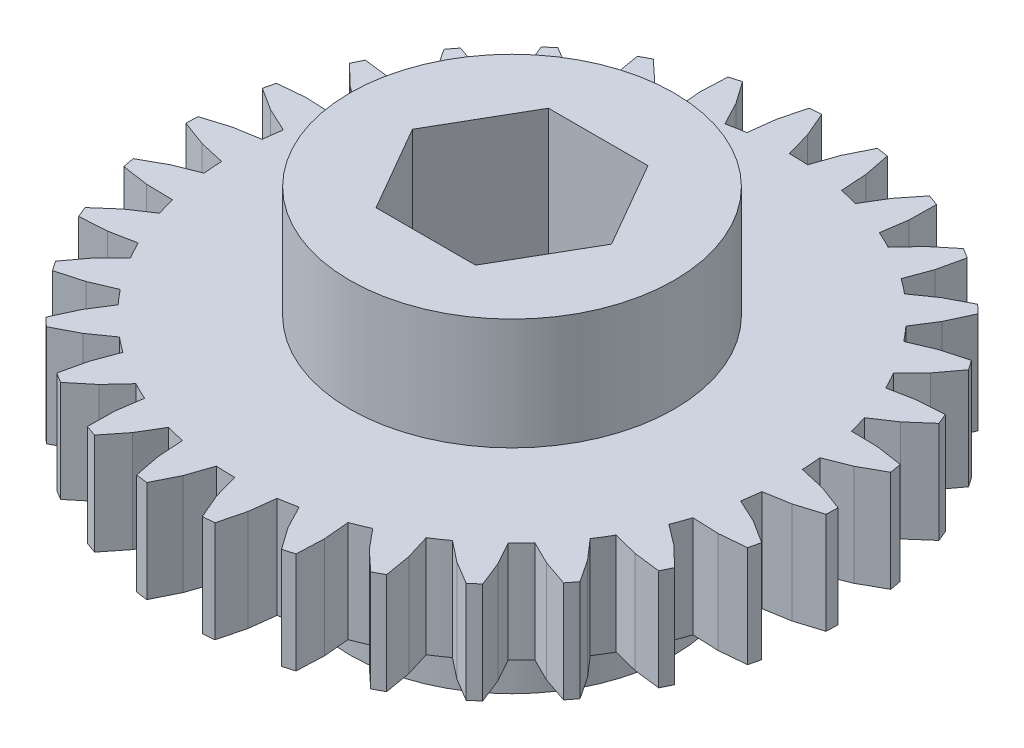
from build123d import *

# Parameters (mm, degrees)
BOSS_EXTRUDE1_DEPTH      = 2.5
BOSS_EXTRUDE1_DEPTH_BACK = 2.5
SKETCH2_R                = 16.25
CUT_EXTRUDE1_DEPTH       = 24.116552511
CUT_EXTRUDE1_DEPTH_BACK  = 24.116552511
BOSS_EXTRUDE2_DEPTH      = 8
BOSS_EXTRUDE2_DEPTH_BACK = 8
SKETCH3_R                = 8
CUT_EXTRUDE2_DEPTH       = 25.314429682
CUT_EXTRUDE2_DEPTH_BACK  = 25.314429682


with BuildPart() as part:
    # Sketch2 → Boss-Extrude1 (new, two sides: drawn at the far end of the back side and taken through both)
    with BuildSketch(Plane(origin=(0, 0, 0), x_dir=(1, 0, 0), z_dir=(0, 1, 0)).offset(-BOSS_EXTRUDE1_DEPTH_BACK)):
        Circle(SKETCH2_R)
    extrude(amount=BOSS_EXTRUDE1_DEPTH + BOSS_EXTRUDE1_DEPTH_BACK)

    # Sketch1 → Cut-Extrude1 (cut, two sides: drawn at the far end of the back side and taken through both)
    with BuildSketch(Plane(origin=(0, 0, 0), x_dir=(1, 0, 0), z_dir=(0, 1, 0)).offset(-CUT_EXTRUDE1_DEPTH_BACK)):
        with BuildLine():
            Line((1.274506229, 14.945756383), (0.855128204, 13.723383539))
            ThreePointArc((0.855128204, 13.723383539), (0.389575726, 13.74448001), (-0.076424274, 13.74978761))
            Line((-0.076424274, 13.74978761), (-0.425890357, 14.993952694))
            Line((-0.425890357, 14.993952694), (-0.95097387, 16.222149941))
            ThreePointArc((-0.95097387, 16.222149941), (0.460407676, 16.243476376), (1.86831527, 16.142239561))
            Line((1.86831527, 16.142239561), (1.274506229, 14.945756383))
        make_face()
        with BuildLine():
            Line((4.354052691, 14.354171002), (5.18364842, 15.40104831))
            ThreePointArc((5.18364842, 15.40104831), (3.827555302, 15.792793306), (2.442581813, 16.065375629))
            Line((2.442581813, 16.065375629), (2.700834426, 14.754846438))
            Line((2.700834426, 14.754846438), (2.78398737, 13.465211262))
            ThreePointArc((2.78398737, 13.465211262), (3.23870064, 13.363132798), (3.689693476, 13.245703532))
            Line((3.689693476, 13.245703532), (4.354052691, 14.354171002))
        make_face()
        with BuildLine():
            Line((7.243306156, 13.13523947), (8.272431259, 13.986757346))
            ThreePointArc((8.272431259, 13.986757346), (7.027420394, 14.651889387), (5.729384951, 15.206467311))
            Line((5.729384951, 15.206467311), (5.709519785, 13.87088259))
            Line((5.709519785, 13.87088259), (5.522725407, 12.592140568))
            ThreePointArc((5.522725407, 12.592140568), (5.946278795, 12.397752558), (6.363001438, 12.18912272))
            Line((6.363001438, 12.18912272), (7.243306156, 13.13523947))
        make_face()
        with BuildLine():
            Line((9.815992386, 11.342234942), (10.999669158, 11.96117797))
            ThreePointArc((10.999669158, 11.96117797), (9.920153494, 12.870627594), (8.765786473, 13.682963404))
            Line((8.765786473, 13.682963404), (8.468671731, 12.380694613))
            Line((8.468671731, 12.380694613), (8.020093843, 11.168732907))
            ThreePointArc((8.020093843, 11.168732907), (8.393976033, 10.890531041), (8.758215705, 10.599818756))
            Line((8.758215705, 10.599818756), (9.815992386, 11.342234942))
        make_face()
        with BuildLine():
            Line((11.959672645, 9.053520322), (13.246168731, 9.41283772))
            ThreePointArc((13.246168731, 9.41283772), (12.379328284, 10.526857615), (11.419081064, 11.561448337))
            Line((11.419081064, 11.561448337), (10.857702086, 10.349410873))
            Line((10.857702086, 10.349410873), (10.166945693, 9.257198025))
            ThreePointArc((10.166945693, 9.257198025), (10.47481624, 8.907341059), (10.770653918, 8.547251849))
            Line((10.770653918, 8.547251849), (11.959672645, 9.053520322))
        make_face()
        with BuildLine():
            Line((13.580657821, 6.36912342), (14.913747169, 6.453111294))
            ThreePointArc((14.913747169, 6.453111294), (14.297467025, 7.723013444), (13.573307018, 8.9346425))
            Line((13.573307018, 8.9346425), (12.772198758, 7.865808215))
            Line((12.772198758, 7.865808215), (11.86945323, 6.941079168))
            ThreePointArc((11.86945323, 6.941079168), (12.097856714, 6.53485753), (12.312362872, 6.121129022))
            Line((12.312362872, 6.121129022), (13.580657821, 6.36912342))
        make_face()
        with BuildLine():
            Line((14.608103084, 3.406365262), (15.929523292, 3.211352939))
            ThreePointArc((15.929523292, 3.211352939), (15.590737851, 4.581636527), (15.134314322, 5.917349913))
            Line((15.134314322, 5.917349913), (14.128489057, 5.038431994))
            Line((14.128489057, 5.038431994), (13.053208705, 4.321601844))
            ThreePointArc((13.053208705, 4.321601844), (13.192162797, 3.876769369), (13.315962488, 3.427483483))
            Line((13.315962488, 3.427483483), (14.608103084, 3.406365262))
        make_face()
        with BuildLine():
            Line((14.997104144, 0.294732596), (16.249102808, -0.170756949))
            ThreePointArc((16.249102808, -0.170756949), (16.20261862, 1.240020109), (16.033879469, 2.64144074))
            Line((16.033879469, 2.64144074), (14.867296588, 1.990852118))
            Line((14.867296588, 1.990852118), (13.666476323, 1.513249783))
            ThreePointArc((13.666476323, 1.513249783), (13.709908063, 1.049247785), (13.737590645, 0.58404047))
            Line((13.737590645, 0.58404047), (14.997104144, 0.294732596))
        make_face()
        with BuildLine():
            Line((14.730659789, -2.829781298), (15.85851856, -3.545403939))
            ThreePointArc((15.85851856, -3.545403939), (16.106367206, -2.155791138), (16.232687143, -0.749912068))
            Line((16.232687143, -0.749912068), (14.956331917, -1.143737549))
            Line((14.956331917, -1.143737549), (13.682453347, -1.361238555))
            ThreePointArc((13.682453347, -1.361238555), (13.628464559, -1.824130963), (13.558820171, -2.284927914))
            Line((13.558820171, -2.284927914), (14.730659789, -2.829781298))
        make_face()
        with BuildLine():
            Line((13.820414915, -5.830620171), (14.774840953, -6.765099764))
            ThreePointArc((14.774840953, -6.765099764), (15.306190258, -5.457383968), (15.722048497, -4.108490121))
            Line((15.722048497, -4.108490121), (14.391703773, -4.228340396))
            Line((14.391703773, -4.228340396), (13.100441504, -4.176234237))
            ThreePointArc((13.100441504, -4.176234237), (12.951391757, -4.617786435), (12.787464193, -5.054033984))
            Line((12.787464193, -5.054033984), (13.820414915, -5.830620171))
        make_face()
        with BuildLine():
            Line((12.306151592, -8.576632964), (13.045431899, -9.689128267))
            ThreePointArc((13.045431899, -9.689128267), (13.837059349, -8.520462932), (14.524280888, -7.28750744))
            Line((14.524280888, -7.28750744), (13.198089115, -7.128144479))
            Line((13.198089115, -7.128144479), (11.945877504, -6.808708442))
            ThreePointArc((11.945877504, -6.808708442), (11.708280988, -7.209622481), (11.457234669, -7.602254517))
            Line((11.457234669, -7.602254517), (12.306151592, -8.576632964))
        make_face()
        with BuildLine():
            Line((10.254050393, -10.947805741), (10.745874872, -12.189695371))
            ThreePointArc((10.745874872, -12.189695371), (11.763182549, -11.211156779), (12.691732509, -10.148025715))
            Line((12.691732509, -10.148025715), (11.427654631, -9.716414443))
            Line((11.427654631, -9.716414443), (10.269221335, -9.143609417))
            ThreePointArc((10.269221335, -9.143609417), (9.953462157, -9.486363428), (9.626269012, -9.818220048))
            Line((9.626269012, -9.818220048), (10.254050393, -10.947805741))
        make_face()
        with BuildLine():
            Line((7.753797987, -12.840506874), (7.976671549, -14.157514295))
            ThreePointArc((7.976671549, -14.157514295), (9.175198225, -13.411869278), (10.304494518, -12.565026571))
            Line((10.304494518, -12.565026571), (9.157776804, -11.880030472))
            Line((9.157776804, -11.880030472), (8.143750916, -11.078890785))
            ThreePointArc((8.143750916, -11.078890785), (7.763629268, -11.348504774), (7.374589207, -11.60508225))
            Line((7.374589207, -11.60508225), (7.753797987, -12.840506874))
        make_face()
        with BuildLine():
            Line((4.914667403, -14.17201624), (4.858849402, -15.506581909))
            ThreePointArc((4.858849402, -15.506581909), (6.186213712, -15.026418732), (7.46690067, -14.432875472))
            Line((7.46690067, -14.432875472), (6.487660186, -13.524432162))
            Line((6.487660186, -13.524432162), (5.662359504, -12.529971462))
            ThreePointArc((5.662359504, -12.529971462), (5.234488525, -12.714662004), (4.800604466, -12.88474667))
            Line((4.800604466, -12.88474667), (4.914667403, -14.17201624))
        make_face()
        with BuildLine():
            Line((1.86074227, -14.884140493), (1.528672222, -16.177937484))
            ThreePointArc((1.528672222, -16.177937484), (2.926861974, -15.984241583), (4.302967432, -15.669938458))
            Line((4.302967432, -15.669938458), (3.534001687, -14.577751269))
            Line((3.534001687, -14.577751269), (2.933495811, -13.433432262))
            ThreePointArc((2.933495811, -13.433432262), (2.476575517, -13.525127493), (2.016810275, -13.601285833))
            Line((2.016810275, -13.601285833), (1.86074227, -14.884140493))
        make_face()
        with BuildLine():
            Line((-1.274506229, -14.945756383), (-1.86831527, -16.142239561))
            ThreePointArc((-1.86831527, -16.142239561), (-0.460407676, -16.243476376), (0.95097387, -16.222149941))
            Line((0.95097387, -16.222149941), (0.425890357, -14.993952694))
            Line((0.425890357, -14.993952694), (0.076424274, -13.74978761))
            ThreePointArc((0.076424274, -13.74978761), (-0.389575726, -13.74448001), (-0.855128204, -13.723383539))
            Line((-0.855128204, -13.723383539), (-1.274506229, -14.945756383))
        make_face()
        with BuildLine():
            Line((-4.354052691, -14.354171002), (-5.18364842, -15.40104831))
            ThreePointArc((-5.18364842, -15.40104831), (-3.827555302, -15.792793306), (-2.442581813, -16.065375629))
            Line((-2.442581813, -16.065375629), (-2.700834426, -14.754846438))
            Line((-2.700834426, -14.754846438), (-2.78398737, -13.465211262))
            ThreePointArc((-2.78398737, -13.465211262), (-3.23870064, -13.363132798), (-3.689693476, -13.245703532))
            Line((-3.689693476, -13.245703532), (-4.354052691, -14.354171002))
        make_face()
        with BuildLine():
            Line((-7.243306156, -13.13523947), (-8.272431259, -13.986757346))
            ThreePointArc((-8.272431259, -13.986757346), (-7.027420394, -14.651889387), (-5.729384951, -15.206467311))
            Line((-5.729384951, -15.206467311), (-5.709519785, -13.87088259))
            Line((-5.709519785, -13.87088259), (-5.522725407, -12.592140568))
            ThreePointArc((-5.522725407, -12.592140568), (-5.946278795, -12.397752558), (-6.363001438, -12.18912272))
            Line((-6.363001438, -12.18912272), (-7.243306156, -13.13523947))
        make_face()
        with BuildLine():
            Line((-9.815992386, -11.342234942), (-10.999669158, -11.96117797))
            ThreePointArc((-10.999669158, -11.96117797), (-9.920153494, -12.870627594), (-8.765786473, -13.682963404))
            Line((-8.765786473, -13.682963404), (-8.468671731, -12.380694613))
            Line((-8.468671731, -12.380694613), (-8.020093843, -11.168732907))
            ThreePointArc((-8.020093843, -11.168732907), (-8.393976033, -10.890531041), (-8.758215705, -10.599818756))
            Line((-8.758215705, -10.599818756), (-9.815992386, -11.342234942))
        make_face()
        with BuildLine():
            Line((-11.959672645, -9.053520322), (-13.246168731, -9.41283772))
            ThreePointArc((-13.246168731, -9.41283772), (-12.379328284, -10.526857615), (-11.419081064, -11.561448337))
            Line((-11.419081064, -11.561448337), (-10.857702086, -10.349410873))
            Line((-10.857702086, -10.349410873), (-10.166945693, -9.257198025))
            ThreePointArc((-10.166945693, -9.257198025), (-10.47481624, -8.907341059), (-10.770653918, -8.547251849))
            Line((-10.770653918, -8.547251849), (-11.959672645, -9.053520322))
        make_face()
        with BuildLine():
            Line((-13.580657821, -6.36912342), (-14.913747169, -6.453111294))
            ThreePointArc((-14.913747169, -6.453111294), (-14.297467025, -7.723013444), (-13.573307018, -8.9346425))
            Line((-13.573307018, -8.9346425), (-12.772198758, -7.865808215))
            Line((-12.772198758, -7.865808215), (-11.86945323, -6.941079168))
            ThreePointArc((-11.86945323, -6.941079168), (-12.097856714, -6.53485753), (-12.312362872, -6.121129022))
            Line((-12.312362872, -6.121129022), (-13.580657821, -6.36912342))
        make_face()
        with BuildLine():
            Line((-14.608103084, -3.406365262), (-15.929523292, -3.211352939))
            ThreePointArc((-15.929523292, -3.211352939), (-15.590737851, -4.581636527), (-15.134314322, -5.917349913))
            Line((-15.134314322, -5.917349913), (-14.128489057, -5.038431994))
            Line((-14.128489057, -5.038431994), (-13.053208705, -4.321601844))
            ThreePointArc((-13.053208705, -4.321601844), (-13.192162797, -3.876769369), (-13.315962488, -3.427483483))
            Line((-13.315962488, -3.427483483), (-14.608103084, -3.406365262))
        make_face()
        with BuildLine():
            Line((-14.997104144, -0.294732596), (-16.249102808, 0.170756949))
            ThreePointArc((-16.249102808, 0.170756949), (-16.20261862, -1.240020109), (-16.033879469, -2.64144074))
            Line((-16.033879469, -2.64144074), (-14.867296588, -1.990852118))
            Line((-14.867296588, -1.990852118), (-13.666476323, -1.513249783))
            ThreePointArc((-13.666476323, -1.513249783), (-13.709908063, -1.049247785), (-13.737590645, -0.58404047))
            Line((-13.737590645, -0.58404047), (-14.997104144, -0.294732596))
        make_face()
        with BuildLine():
            Line((-14.730659789, 2.829781298), (-15.85851856, 3.545403939))
            ThreePointArc((-15.85851856, 3.545403939), (-16.106367206, 2.155791138), (-16.232687143, 0.749912068))
            Line((-16.232687143, 0.749912068), (-14.956331917, 1.143737549))
            Line((-14.956331917, 1.143737549), (-13.682453347, 1.361238555))
            ThreePointArc((-13.682453347, 1.361238555), (-13.628464559, 1.824130963), (-13.558820171, 2.284927914))
            Line((-13.558820171, 2.284927914), (-14.730659789, 2.829781298))
        make_face()
        with BuildLine():
            Line((-13.820414915, 5.830620171), (-14.774840953, 6.765099764))
            ThreePointArc((-14.774840953, 6.765099764), (-15.306190258, 5.457383968), (-15.722048497, 4.108490121))
            Line((-15.722048497, 4.108490121), (-14.391703773, 4.228340396))
            Line((-14.391703773, 4.228340396), (-13.100441504, 4.176234237))
            ThreePointArc((-13.100441504, 4.176234237), (-12.951391757, 4.617786435), (-12.787464193, 5.054033984))
            Line((-12.787464193, 5.054033984), (-13.820414915, 5.830620171))
        make_face()
        with BuildLine():
            Line((-12.306151592, 8.576632964), (-13.045431899, 9.689128267))
            ThreePointArc((-13.045431899, 9.689128267), (-13.837059349, 8.520462932), (-14.524280888, 7.28750744))
            Line((-14.524280888, 7.28750744), (-13.198089115, 7.128144479))
            Line((-13.198089115, 7.128144479), (-11.945877504, 6.808708442))
            ThreePointArc((-11.945877504, 6.808708442), (-11.708280988, 7.209622481), (-11.457234669, 7.602254517))
            Line((-11.457234669, 7.602254517), (-12.306151592, 8.576632964))
        make_face()
        with BuildLine():
            Line((-10.254050393, 10.947805741), (-10.745874872, 12.189695371))
            ThreePointArc((-10.745874872, 12.189695371), (-11.763182549, 11.211156779), (-12.691732509, 10.148025715))
            Line((-12.691732509, 10.148025715), (-11.427654631, 9.716414443))
            Line((-11.427654631, 9.716414443), (-10.269221335, 9.143609417))
            ThreePointArc((-10.269221335, 9.143609417), (-9.953462157, 9.486363428), (-9.626269012, 9.818220048))
            Line((-9.626269012, 9.818220048), (-10.254050393, 10.947805741))
        make_face()
        with BuildLine():
            Line((-7.753797987, 12.840506874), (-7.976671549, 14.157514295))
            ThreePointArc((-7.976671549, 14.157514295), (-9.175198225, 13.411869278), (-10.304494518, 12.565026571))
            Line((-10.304494518, 12.565026571), (-9.157776804, 11.880030472))
            Line((-9.157776804, 11.880030472), (-8.143750916, 11.078890785))
            ThreePointArc((-8.143750916, 11.078890785), (-7.763629268, 11.348504774), (-7.374589207, 11.60508225))
            Line((-7.374589207, 11.60508225), (-7.753797987, 12.840506874))
        make_face()
        with BuildLine():
            Line((-4.914667403, 14.17201624), (-4.858849402, 15.506581909))
            ThreePointArc((-4.858849402, 15.506581909), (-6.186213712, 15.026418732), (-7.46690067, 14.432875472))
            Line((-7.46690067, 14.432875472), (-6.487660186, 13.524432162))
            Line((-6.487660186, 13.524432162), (-5.662359504, 12.529971462))
            ThreePointArc((-5.662359504, 12.529971462), (-5.234488525, 12.714662004), (-4.800604466, 12.88474667))
            Line((-4.800604466, 12.88474667), (-4.914667403, 14.17201624))
        make_face()
        with BuildLine():
            Line((-1.86074227, 14.884140493), (-1.528672222, 16.177937484))
            ThreePointArc((-1.528672222, 16.177937484), (-2.926861974, 15.984241583), (-4.302967432, 15.669938458))
            Line((-4.302967432, 15.669938458), (-3.534001687, 14.577751269))
            Line((-3.534001687, 14.577751269), (-2.933495811, 13.433432262))
            ThreePointArc((-2.933495811, 13.433432262), (-2.476575517, 13.525127493), (-2.016810275, 13.601285833))
            Line((-2.016810275, 13.601285833), (-1.86074227, 14.884140493))
        make_face()
    extrude(amount=CUT_EXTRUDE1_DEPTH + CUT_EXTRUDE1_DEPTH_BACK, mode=Mode.SUBTRACT)

    # Sketch3 → Boss-Extrude2 (add, two sides: drawn at the far end of the back side and taken through both)
    with BuildSketch(Plane(origin=(0, 0, 0), x_dir=(1, 0, 0), z_dir=(0, 1, 0)).offset(-BOSS_EXTRUDE2_DEPTH_BACK)):
        Circle(SKETCH3_R)
    extrude(amount=BOSS_EXTRUDE2_DEPTH + BOSS_EXTRUDE2_DEPTH_BACK)

    # Sketch4 → Cut-Extrude2 (cut, two sides: drawn at the far end of the back side and taken through both)
    with BuildSketch(Plane(origin=(0, 0, 0), x_dir=(1, 0, 0), z_dir=(0, 1, 0)).offset(-CUT_EXTRUDE2_DEPTH_BACK)):
        Polygon((4.907477288, 0), (2.453738644, 4.25), (-2.453738644, 4.25), (-4.907477288, 0), (-2.453738644, -4.25), (2.453738644, -4.25), align=None)
    extrude(amount=CUT_EXTRUDE2_DEPTH + CUT_EXTRUDE2_DEPTH_BACK, mode=Mode.SUBTRACT)


solid = part.part
